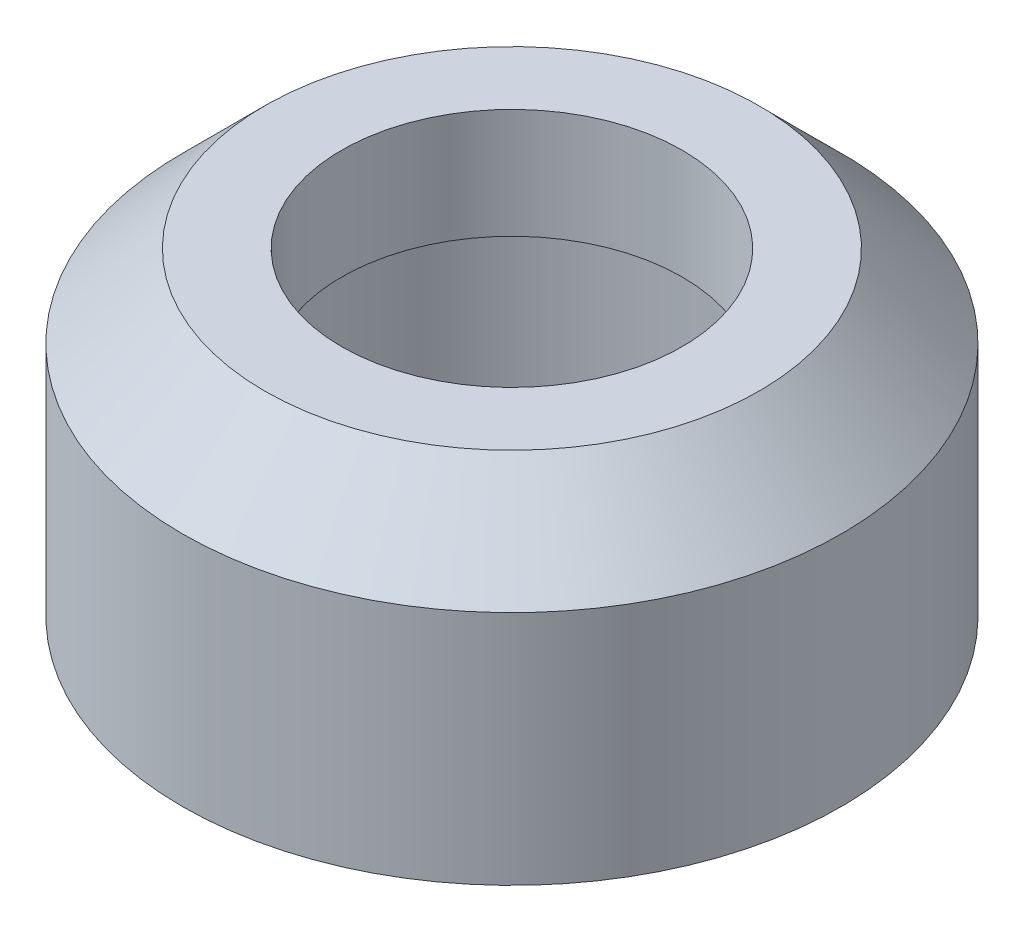
from build123d import *

# Parameters (mm, degrees)
SKETCH1_R           = 6
SKETCH1_R_2         = 3.1
BOSS_EXTRUDE1_DEPTH = 5.8
SKETCH2_R           = 4.1
CUT_EXTRUDE1_DEPTH  = 3.8
CHAMFER1_SIZE       = 1.5


with BuildPart() as part:
    # Sketch1 → Boss-Extrude1 (new body)
    with BuildSketch(Plane(origin=(0, 0, 0), x_dir=(1, 0, 0), z_dir=(0, 1, 0))):
        with Locations(Location((0, 0, 0), (0, 0, 270))):
            Circle(SKETCH1_R)
        with Locations(Location((0, 0, 0), (0, 0, 270))):
            Circle(SKETCH1_R_2, mode=Mode.SUBTRACT)
    extrude(amount=BOSS_EXTRUDE1_DEPTH)

    # Sketch2 → Cut-Extrude1 (cut)
    with BuildSketch(Plane.XZ):
        with Locations(Location((0, 0, 0), (0, 0, 270))):
            Circle(SKETCH2_R)
    extrude(amount=-CUT_EXTRUDE1_DEPTH, mode=Mode.SUBTRACT)

    # Chamfer1
    chamfer1_edges = [part.edges().sort_by_distance(p)[0] for p in [
        (0, 5.8, -6),
    ]]
    chamfer(chamfer1_edges, length=CHAMFER1_SIZE)


solid = part.part
